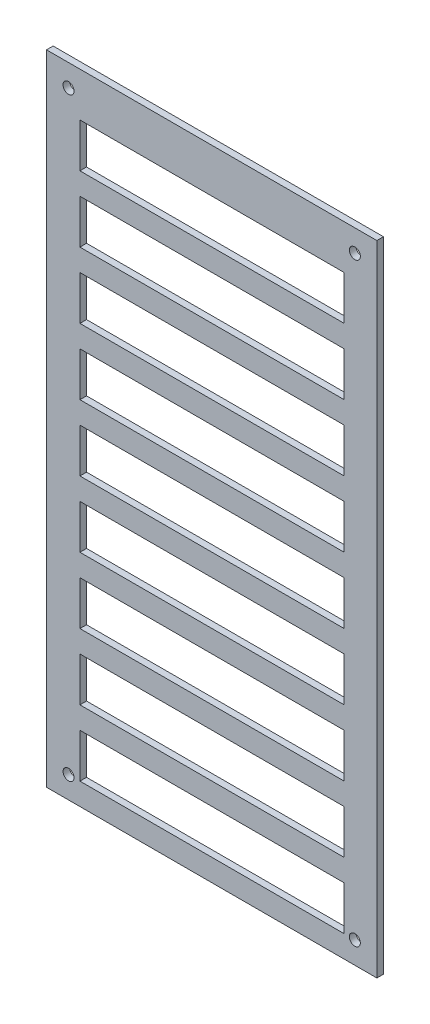
from build123d import *

# Parameters (mm, degrees)
SKETCH_1_W             = 150
SKETCH_1_H             = 290
EXTRUDE_1_DEPTH        = 3
SKETCH_2_R             = 2.5
CUT_EXTRUDE_1_DEPTH    = 3
SKETCH_3_W             = 120
SKETCH_3_H             = 20
CUT_EXTRUDE_2_DEPTH    = 3
PATTERN_LINEAR_1_COUNT = 9
PATTERN_LINEAR_1_PITCH = 30


with BuildPart() as part:
    # 草图1 → 凸台-拉伸1 (new body)
    with BuildSketch(Plane.XY):
        with Locations((49.855231415, -95.12154255)):
            Rectangle(SKETCH_1_W, SKETCH_1_H)
    extrude(amount=EXTRUDE_1_DEPTH)

    # 草图2 → 切除-拉伸1 (cut)
    with BuildSketch(Plane.XY.offset(3)):
        with Locations((114.855231415, 39.87845745)):
            Circle(SKETCH_2_R)
        with Locations((114.855231415, -230.12154255)):
            Circle(SKETCH_2_R)
        with Locations((-15.144768585, 39.87845745)):
            Circle(SKETCH_2_R)
        with Locations((-15.144768585, -230.12154255)):
            Circle(SKETCH_2_R)
    extrude(amount=-CUT_EXTRUDE_1_DEPTH, mode=Mode.SUBTRACT)

    # 草图3 → 切除-拉伸2 (cut)
    with BuildSketch(Plane.XY.offset(3)):
        with Locations((50.020248586, 19.87845745)):
            Rectangle(SKETCH_3_W, SKETCH_3_H)
    cut_extrude_2 = extrude(amount=-CUT_EXTRUDE_2_DEPTH, mode=Mode.SUBTRACT)

    # 阵列(线性)1: 切除-拉伸2 ×9
    with Locations(*[(0, -i * PATTERN_LINEAR_1_PITCH, 0) for i in range(1, PATTERN_LINEAR_1_COUNT)]):
        add(cut_extrude_2, mode=Mode.SUBTRACT)


solid = part.part
